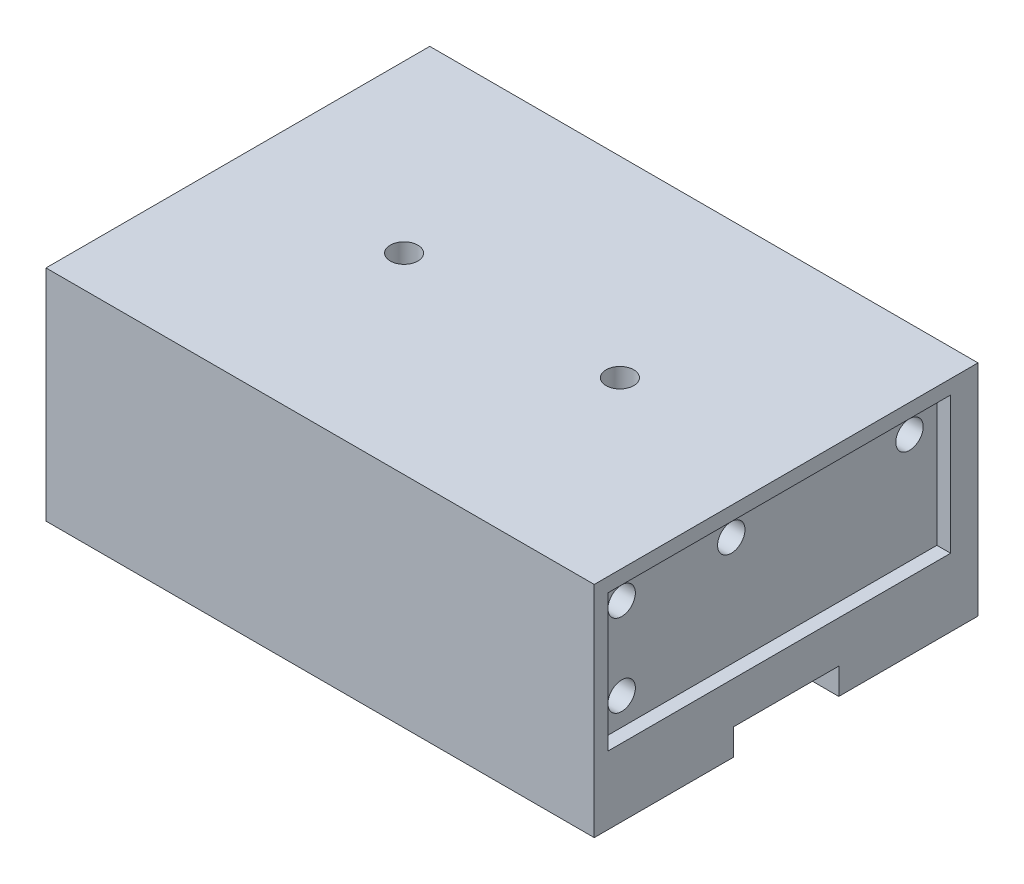
from build123d import *

# Parameters (mm, degrees)
SKETCH2_W           = 63.5
SKETCH2_H           = 44.45
BOSS_EXTRUDE1_DEPTH = 25.4
SKETCH3_W           = 63.5
SKETCH3_H           = 12.2
CUT_EXTRUDE1_DEPTH  = 3.048
SKETCH4_R           = 1.6
CUT_EXTRUDE2_DEPTH  = 47.337599474
SKETCH10_R          = 1.5875
CUT_EXTRUDE3_DEPTH  = 6.35
SKETCH8_R           = 1.5875
CUT_EXTRUDE4_DEPTH  = 6.35
SKETCH5_R           = 1.5875
CUT_EXTRUDE5_DEPTH  = 6.35
SKETCH6_R           = 1.5875
CUT_EXTRUDE6_DEPTH  = 6.35
SKETCH11_W          = 39.6875
SKETCH11_H          = 15.875
CUT_EXTRUDE8_DEPTH  = 1.5875


with BuildPart() as part:
    # Sketch2 → Boss-Extrude1 (new body)
    with BuildSketch(Plane(origin=(0, 0, 0), x_dir=(1, 0, 0), z_dir=(0, 1, 0))):
        Rectangle(SKETCH2_W, SKETCH2_H)
    extrude(amount=BOSS_EXTRUDE1_DEPTH)

    # Sketch3 → Cut-Extrude1 (cut)
    with BuildSketch(Plane.XZ):
        Rectangle(SKETCH3_W, SKETCH3_H)
    extrude(amount=-CUT_EXTRUDE1_DEPTH, mode=Mode.SUBTRACT)

    # Sketch4 → Cut-Extrude2 (cut, through all)
    with BuildSketch(Plane(origin=(0, 25.4, 0), x_dir=(1, 0, 0), z_dir=(0, 1, 0))):
        with Locations(Location((-12.5, 0, 0), (0, 0, 270))):
            Circle(SKETCH4_R)
        with Locations(Location((12.5, 0, 0), (0, 0, 270))):
            Circle(SKETCH4_R)
    extrude(amount=-CUT_EXTRUDE2_DEPTH, mode=Mode.SUBTRACT)

    # Sketch10 → Cut-Extrude3 (cut)
    with BuildSketch(Plane(origin=(31.75, 0, 0), x_dir=(0, 0, -1), z_dir=(1, 0, 0))):
        with Locations((15.875, 20.590962003)):
            Circle(SKETCH10_R)
    extrude(amount=-CUT_EXTRUDE3_DEPTH, mode=Mode.SUBTRACT)

    # Sketch8 → Cut-Extrude4 (cut)
    with BuildSketch(Plane(origin=(31.75, 1.540962003, -6.057895699), x_dir=(0, 0, -1), z_dir=(1, 0, 0))):
        with Locations((-10.820395699, 19.05)):
            Circle(SKETCH8_R)
    extrude(amount=-CUT_EXTRUDE4_DEPTH, mode=Mode.SUBTRACT)

    # Sketch5 → Cut-Extrude5 (cut)
    with BuildSketch(Plane(origin=(31.75, 1.540962003, -6.057895699), x_dir=(0, 0, -1), z_dir=(1, 0, 0))):
        with Locations((-23.520395699, 19.05)):
            Circle(SKETCH5_R)
    extrude(amount=-CUT_EXTRUDE5_DEPTH, mode=Mode.SUBTRACT)

    # Sketch6 → Cut-Extrude6 (cut)
    with BuildSketch(Plane(origin=(31.75, 1.540962003, -6.057895699), x_dir=(0, 0, -1), z_dir=(1, 0, 0))):
        with Locations((-23.520395699, 9.525)):
            Circle(SKETCH6_R)
    extrude(amount=-CUT_EXTRUDE6_DEPTH, mode=Mode.SUBTRACT)

    # Sketch11 → Cut-Extrude8 (cut)
    with BuildSketch(Plane(origin=(31.75, 1.540962003, -6.057895699), x_dir=(0, 0, -1), z_dir=(1, 0, 0))):
        with Locations((-6.851645699, 14.2875)):
            Rectangle(SKETCH11_W, SKETCH11_H)
    extrude(amount=-CUT_EXTRUDE8_DEPTH, mode=Mode.SUBTRACT)


solid = part.part
